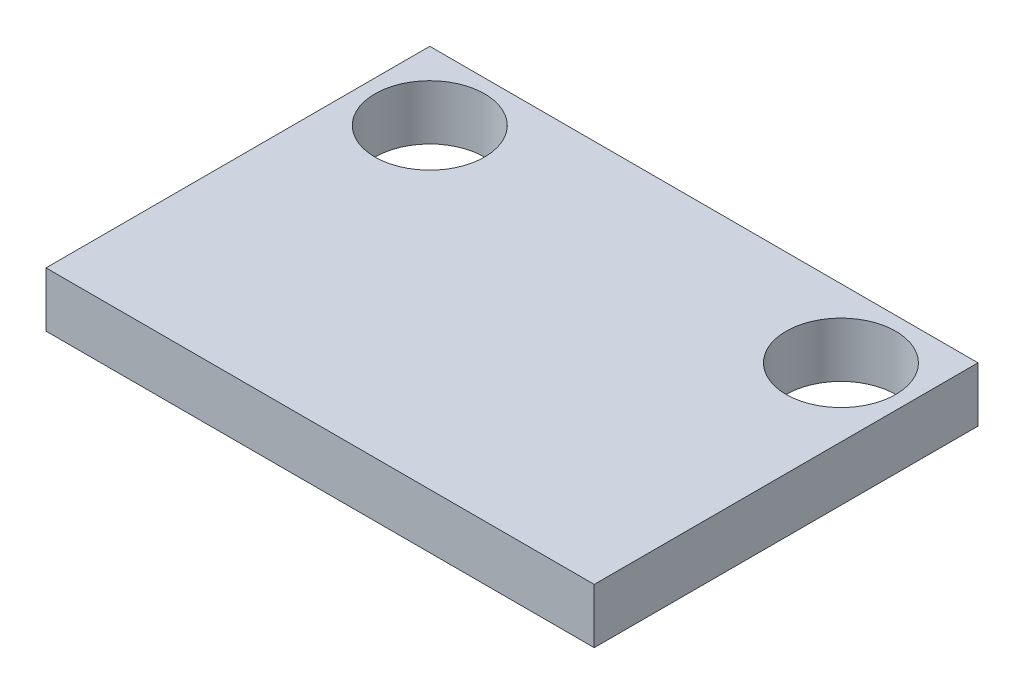
from build123d import *

# Parameters (mm, degrees)
SKETCH1_W           = 20
SKETCH1_H           = 14
SKETCH1_R           = 2
BOSS_EXTRUDE1_DEPTH = 2


with BuildPart() as part:
    # Sketch1 → Boss-Extrude1 (new body)
    with BuildSketch(Plane(origin=(0, 0, 0), x_dir=(1, 0, 0), z_dir=(0, 1, 0))):
        Rectangle(SKETCH1_W, SKETCH1_H)
        with Locations(Location((-7.5, 4.5, 0), (0, 0, 270))):
            Circle(SKETCH1_R, mode=Mode.SUBTRACT)
        with Locations(Location((7.5, 4.5, 0), (0, 0, 270))):
            Circle(SKETCH1_R, mode=Mode.SUBTRACT)
    extrude(amount=BOSS_EXTRUDE1_DEPTH)


solid = part.part
